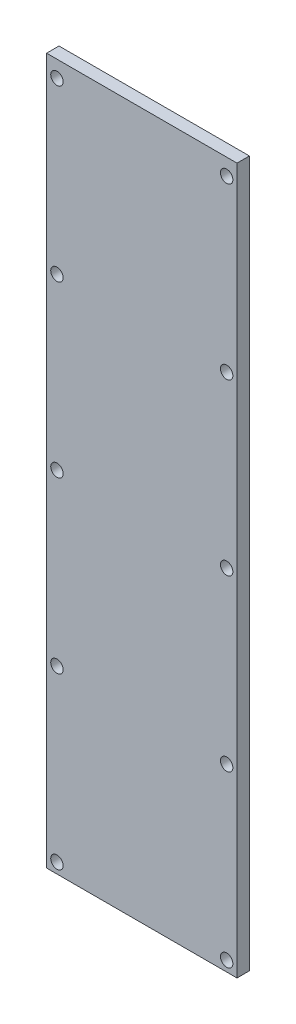
from build123d import *

# Parameters (mm, degrees)
SKICA1_W                = 46
SKICA1_H                = 170.5
SKICA1_R                = 1.5
P_IDAT_VYSUNUT_M1_DEPTH = 3
SKICA2_W                = 36
SKICA2_H                = 160.5
SKICA2_W_2              = 34
SKICA2_H_2              = 158.5
P_IDAT_VYSUNUT_M2_DEPTH = 6


with BuildPart() as part:
    # Skica1 → Přidat vysunutím1 (new body)
    with BuildSketch(Plane.XY):
        with Locations((-17, 72.25)):
            Rectangle(SKICA1_W, SKICA1_H)
        with Locations((-37.5, -10.5)):
            Circle(SKICA1_R, mode=Mode.SUBTRACT)
        with Locations((3.5, -10.5)):
            Circle(SKICA1_R, mode=Mode.SUBTRACT)
        with Locations((3.5, 30.5)):
            Circle(SKICA1_R, mode=Mode.SUBTRACT)
        with Locations((3.5, 71.5)):
            Circle(SKICA1_R, mode=Mode.SUBTRACT)
        with Locations((3.5, 112.5)):
            Circle(SKICA1_R, mode=Mode.SUBTRACT)
        with Locations((3.5, 153.5)):
            Circle(SKICA1_R, mode=Mode.SUBTRACT)
        with Locations((-37.5, 30.5)):
            Circle(SKICA1_R, mode=Mode.SUBTRACT)
        with Locations((-37.5, 71.5)):
            Circle(SKICA1_R, mode=Mode.SUBTRACT)
        with Locations((-37.5, 112.5)):
            Circle(SKICA1_R, mode=Mode.SUBTRACT)
        with Locations((-37.5, 153.5)):
            Circle(SKICA1_R, mode=Mode.SUBTRACT)
    extrude(amount=P_IDAT_VYSUNUT_M1_DEPTH)

    # Skica2 → Přidat vysunutím2 (add)
    with BuildSketch(Plane.XY.offset(3)):
        with Locations((-17, 72.25)):
            Rectangle(SKICA2_W, SKICA2_H)
        with Locations((-17, 72.25)):
            Rectangle(SKICA2_W_2, SKICA2_H_2, mode=Mode.SUBTRACT)
    extrude(amount=-P_IDAT_VYSUNUT_M2_DEPTH)


solid = part.part
